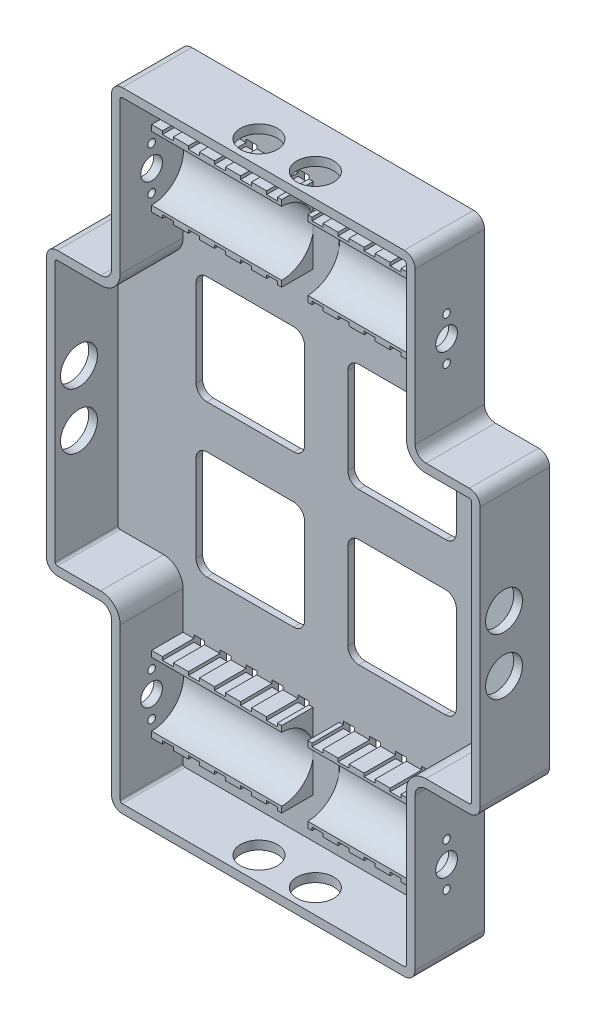
from build123d import *

# Parameters (mm, degrees)
BOSS_EXTRUDE1_DEPTH                          = 3
FILLET1_R                                    = 5
BOSS_EXTRUDE2_START                          = 29
BOSS_EXTRUDE2_DEPTH                          = 29
SKETCH3_R                                    = 5
SKETCH3_R_2                                  = 1.75
CUT_EXTRUDE1_DEPTH                           = 29
SKETCH4_W                                    = 60
SKETCH4_H                                    = 35
BOSS_EXTRUDE3_DEPTH                          = 14.5
SKETCH5_R                                    = 14.75
CUT_EXTRUDE2_DEPTH                           = 60
SKETCH7_W                                    = 5
SKETCH7_H                                    = 3
CUT_EXTRUDE3_DEPTH                           = 178.006355818
CUT_EXTRUDE4_DEPTH                           = 5
LPATTERN1_COUNT                              = 5
LPATTERN1_PITCH                              = 12
MIRROR1_COPY_1_SKETCH_W                      = 5
MIRROR1_COPY_1_SKETCH_H                      = 3
MIRROR1_COPY_1_DEPTH                         = 178.006355818
MIRROR1_COPY_2_SKETCH_W                      = 5
MIRROR1_COPY_2_SKETCH_H                      = 3
MIRROR1_COPY_2_DEPTH                         = 178.006355818
MIRROR1_COPY_3_SKETCH_W                      = 5
MIRROR1_COPY_3_SKETCH_H                      = 3
MIRROR1_COPY_3_DEPTH                         = 178.006355818
MIRROR1_COPY_4_SKETCH_W                      = 5
MIRROR1_COPY_4_SKETCH_H                      = 3
MIRROR1_COPY_4_DEPTH                         = 178.006355818
MIRROR1_COPY_5_DEPTH                         = 5
MIRROR1_COPY_6_DEPTH                         = 5
MIRROR1_COPY_7_DEPTH                         = 5
MIRROR1_COPY_8_DEPTH                         = 5
MIRROR1_AT_THE_SECOND_PLANE_COPY_1_SKETC_W   = 5
MIRROR1_AT_THE_SECOND_PLANE_COPY_1_SKETC_H   = 3
MIRROR1_AT_THE_SECOND_PLANE_COPY_1_DEPTH     = 178.006355818
MIRROR1_AT_THE_SECOND_PLANE_COPY_2_SKETC_W   = 5
MIRROR1_AT_THE_SECOND_PLANE_COPY_2_SKETC_H   = 3
MIRROR1_AT_THE_SECOND_PLANE_COPY_2_DEPTH     = 178.006355818
MIRROR1_AT_THE_SECOND_PLANE_COPY_3_SKETC_W   = 5
MIRROR1_AT_THE_SECOND_PLANE_COPY_3_SKETC_H   = 3
MIRROR1_AT_THE_SECOND_PLANE_COPY_3_DEPTH     = 178.006355818
MIRROR1_AT_THE_SECOND_PLANE_COPY_4_SKETC_W   = 5
MIRROR1_AT_THE_SECOND_PLANE_COPY_4_SKETC_H   = 3
MIRROR1_AT_THE_SECOND_PLANE_COPY_4_DEPTH     = 178.006355818
MIRROR1_AT_THE_SECOND_PLANE_COPY_5_DEPTH     = 5
MIRROR1_AT_THE_SECOND_PLANE_COPY_6_DEPTH     = 5
MIRROR1_AT_THE_SECOND_PLANE_COPY_7_DEPTH     = 5
MIRROR1_AT_THE_SECOND_PLANE_COPY_8_DEPTH     = 5
MIRROR1_AT_THE_SECOND_PLANE_COPY_9_SKETC_R   = 5
MIRROR1_AT_THE_SECOND_PLANE_COPY_9_SKETC_R_2 = 1.75
MIRROR1_AT_THE_SECOND_PLANE_COPY_9_DEPTH     = 29
MIRROR1_AT_THE_SECOND_PLANE_COPY_10_SKET_W   = 60
MIRROR1_AT_THE_SECOND_PLANE_COPY_10_SKET_H   = 35
MIRROR1_AT_THE_SECOND_PLANE_COPY_10_DEPTH    = 14.5
MIRROR1_AT_THE_SECOND_PLANE_COPY_11_SKET_R   = 14.75
MIRROR1_AT_THE_SECOND_PLANE_COPY_11_DEPTH    = 60
MIRROR1_AT_THE_SECOND_PLANE_COPY_12_SKET_W   = 5
MIRROR1_AT_THE_SECOND_PLANE_COPY_12_SKET_H   = 3
MIRROR1_AT_THE_SECOND_PLANE_COPY_12_DEPTH    = 178.006355818
MIRROR1_AT_THE_SECOND_PLANE_COPY_13_DEPTH    = 5
MIRROR1_AT_THE_SECOND_PLANE_COPY_14_SKET_W   = 5
MIRROR1_AT_THE_SECOND_PLANE_COPY_14_SKET_H   = 3
MIRROR1_AT_THE_SECOND_PLANE_COPY_14_DEPTH    = 178.006355818
MIRROR1_AT_THE_SECOND_PLANE_COPY_15_SKET_W   = 5
MIRROR1_AT_THE_SECOND_PLANE_COPY_15_SKET_H   = 3
MIRROR1_AT_THE_SECOND_PLANE_COPY_15_DEPTH    = 178.006355818
MIRROR1_AT_THE_SECOND_PLANE_COPY_16_SKET_W   = 5
MIRROR1_AT_THE_SECOND_PLANE_COPY_16_SKET_H   = 3
MIRROR1_AT_THE_SECOND_PLANE_COPY_16_DEPTH    = 178.006355818
MIRROR1_AT_THE_SECOND_PLANE_COPY_17_SKET_W   = 5
MIRROR1_AT_THE_SECOND_PLANE_COPY_17_SKET_H   = 3
MIRROR1_AT_THE_SECOND_PLANE_COPY_17_DEPTH    = 178.006355818
MIRROR1_AT_THE_SECOND_PLANE_COPY_18_DEPTH    = 5
MIRROR1_AT_THE_SECOND_PLANE_COPY_19_DEPTH    = 5
MIRROR1_AT_THE_SECOND_PLANE_COPY_20_DEPTH    = 5
MIRROR1_AT_THE_SECOND_PLANE_COPY_21_DEPTH    = 5
CUT_EXTRUDE6_REACH                           = 310.422
SKETCH11_R                                   = 8.5
SKETCH12_R                                   = 8.5
CUT_EXTRUDE7_DEPTH                           = 250.096366894
CUT_EXTRUDE8_DEPTH                           = 180.022344974
MIRROR3_AT_THE_SECOND_PLANE_COPY_1_DEPTH     = 180.022344974


with BuildPart() as part:
    # Sketch1 → Boss-Extrude1 (new body)
    with BuildSketch(Plane.XY):
        Polygon((-70, -145), (70, -145), (70, -65), (100, -65), (100, 65), (70, 65), (70, 145), (-70, 145), (-70, 65), (-100, 65), (-100, -65), (-70, -65), align=None)
    extrude(amount=BOSS_EXTRUDE1_DEPTH)

    # Fillet1
    fillet1_edges = [part.edges().sort_by_distance(p)[0] for p in [
        (-70, -65, 1.5),
        (-100, -65, 1.5),
        (-100, 65, 1.5),
        (-70, 65, 1.5),
        (-70, 145, 1.5),
        (70, 145, 1.5),
        (70, 65, 1.5),
        (100, 65, 1.5),
        (100, -65, 1.5),
        (70, -65, 1.5),
        (70, -145, 1.5),
        (-70, -145, 1.5),
    ]]
    fillet(fillet1_edges, radius=FILLET1_R)

    # Sketch2 → Boss-Extrude2 (add)
    with BuildSketch(Plane.XY.offset(3).offset(BOSS_EXTRUDE2_START)):
        with BuildLine():
            Line((-100, 60), (-100, -60))
            ThreePointArc((-100, -60), (-98.535533906, -63.535533906), (-95, -65))
            Line((-95, -65), (-75, -65))
            ThreePointArc((-75, -65), (-71.464466094, -66.464466094), (-70, -70))
            Line((-70, -70), (-70, -140))
            ThreePointArc((-70, -140), (-68.535533906, -143.535533906), (-65, -145))
            Line((-65, -145), (65, -145))
            ThreePointArc((65, -145), (68.535533906, -143.535533906), (70, -140))
            Line((70, -140), (70, -70))
            ThreePointArc((70, -70), (71.464466094, -66.464466094), (75, -65))
            Line((75, -65), (95, -65))
            ThreePointArc((95, -65), (98.535533906, -63.535533906), (100, -60))
            Line((100, -60), (100, 60))
            ThreePointArc((100, 60), (98.535533906, 63.535533906), (95, 65))
            Line((95, 65), (75, 65))
            ThreePointArc((75, 65), (71.464466094, 66.464466094), (70, 70))
            Line((70, 70), (70, 140))
            ThreePointArc((70, 140), (68.535533906, 143.535533906), (65, 145))
            Line((65, 145), (-65, 145))
            ThreePointArc((-65, 145), (-68.535533906, 143.535533906), (-70, 140))
            Line((-70, 140), (-70, 70))
            ThreePointArc((-70, 70), (-71.464466094, 66.464466094), (-75, 65))
            Line((-75, 65), (-95, 65))
            ThreePointArc((-95, 65), (-98.535533906, 63.535533906), (-100, 60))
        make_face()
        with BuildLine():
            Line((-96, 60), (-96, -60))
            ThreePointArc((-96, -60), (-95.707106781, -60.707106781), (-95, -61))
            Line((-95, -61), (-75, -61))
            ThreePointArc((-75, -61), (-68.636038969, -63.636038969), (-66, -70))
            Line((-66, -70), (-66, -140))
            ThreePointArc((-66, -140), (-65.707106781, -140.707106781), (-65, -141))
            Line((-65, -141), (65, -141))
            ThreePointArc((65, -141), (65.707106781, -140.707106781), (66, -140))
            Line((66, -140), (66, -70))
            ThreePointArc((66, -70), (68.636038969, -63.636038969), (75, -61))
            Line((75, -61), (95, -61))
            ThreePointArc((95, -61), (95.707106781, -60.707106781), (96, -60))
            Line((96, -60), (96, 60))
            ThreePointArc((96, 60), (95.707106781, 60.707106781), (95, 61))
            Line((95, 61), (75, 61))
            ThreePointArc((75, 61), (68.636038969, 63.636038969), (66, 70))
            Line((66, 70), (66, 140))
            ThreePointArc((66, 140), (65.707106781, 140.707106781), (65, 141))
            Line((65, 141), (-65, 141))
            ThreePointArc((-65, 141), (-65.707106781, 140.707106781), (-66, 140))
            Line((-66, 140), (-66, 70))
            ThreePointArc((-66, 70), (-68.636038969, 63.636038969), (-75, 61))
            Line((-75, 61), (-95, 61))
            ThreePointArc((-95, 61), (-95.707106781, 60.707106781), (-96, 60))
        make_face(mode=Mode.SUBTRACT)
    extrude(amount=-BOSS_EXTRUDE2_DEPTH)

    # Sketch3 → Cut-Extrude1 (cut)
    with BuildSketch(Plane.ZY.offset(70)):
        with Locations(Location((17.5, -105, 0), (0, 0, 270))):
            Circle(SKETCH3_R)
        with Locations(Location((17.5, -95, 0), (0, 0, 270))):
            Circle(SKETCH3_R_2)
        with Locations(Location((17.5, -115, 0), (0, 0, 270))):
            Circle(SKETCH3_R_2)
    cut_extrude1 = extrude(amount=-CUT_EXTRUDE1_DEPTH, mode=Mode.SUBTRACT)

    # Sketch4 → Boss-Extrude3 (add)
    with BuildSketch(Plane.XY.offset(3)):
        with Locations((-36, -105)):
            Rectangle(SKETCH4_W, SKETCH4_H)
    boss_extrude3 = extrude(amount=BOSS_EXTRUDE3_DEPTH)

    # Sketch5 → Cut-Extrude2 (cut)
    with BuildSketch(Plane(origin=(-6, 0, 0), x_dir=(0, 0, -1), z_dir=(1, 0, 0))):
        with Locations((-17.5, -105)):
            Circle(SKETCH5_R)
    cut_extrude2 = extrude(amount=-CUT_EXTRUDE2_DEPTH, mode=Mode.SUBTRACT)

    # Sketch7 → Cut-Extrude3 (cut, through all)
    with BuildSketch(Plane.XY.offset(17.5)):
        with Locations((-58.5, -122.5)):
            Rectangle(SKETCH7_W, SKETCH7_H)
        with Locations((-58.5, -87.5)):
            Rectangle(SKETCH7_W, SKETCH7_H)
    cut_extrude3 = extrude(amount=-CUT_EXTRUDE3_DEPTH, mode=Mode.SUBTRACT)

    # Sketch8 → Cut-Extrude4 (cut)
    with BuildSketch(Plane(origin=(-61, 0, 0), x_dir=(0, 0, -1), z_dir=(1, 0, 0))):
        Polygon((0, -89), (0, -121), (-3, -121), (-1.5, -119.5), (-1.5, -90.5), (-3, -89), align=None)
    cut_extrude4 = extrude(amount=CUT_EXTRUDE4_DEPTH, mode=Mode.SUBTRACT)

    # LPattern1: Cut-Extrude3, Cut-Extrude4 ×5
    with Locations(*[(i * LPATTERN1_PITCH, 0, 0) for i in range(1, LPATTERN1_COUNT)]):
        add(cut_extrude3, mode=Mode.SUBTRACT)
        add(cut_extrude4, mode=Mode.SUBTRACT)

    # Mirror1: Cut-Extrude1, Boss-Extrude3, Cut-Extrude2, Cut-Extrude3, Cut-Extrude4 across plane
    add(cut_extrude1.mirror(Plane(origin=(0, 0, 0), x_dir=(0, 0, 1), z_dir=(1, 0, 0))), mode=Mode.SUBTRACT)
    add(boss_extrude3.mirror(Plane(origin=(0, 0, 0), x_dir=(0, 0, 1), z_dir=(1, 0, 0))))
    add(cut_extrude2.mirror(Plane(origin=(0, 0, 0), x_dir=(0, 0, 1), z_dir=(1, 0, 0))), mode=Mode.SUBTRACT)
    add(cut_extrude3.mirror(Plane(origin=(0, 0, 0), x_dir=(0, 0, 1), z_dir=(1, 0, 0))), mode=Mode.SUBTRACT)
    add(cut_extrude4.mirror(Plane(origin=(0, 0, 0), x_dir=(0, 0, 1), z_dir=(1, 0, 0))), mode=Mode.SUBTRACT)

    # Mirror1 copy 1 sketch → Mirror1 copy 1 (cut, through all)
    with BuildSketch(Plane(origin=(-12, 0, 17.5), x_dir=(-1, 0, 0), z_dir=(0, 0, 1))):
        with Locations((-58.5, 122.5)):
            Rectangle(MIRROR1_COPY_1_SKETCH_W, MIRROR1_COPY_1_SKETCH_H)
        with Locations((-58.5, 87.5)):
            Rectangle(MIRROR1_COPY_1_SKETCH_W, MIRROR1_COPY_1_SKETCH_H)
    extrude(amount=-MIRROR1_COPY_1_DEPTH, mode=Mode.SUBTRACT)

    # Mirror1 copy 2 sketch → Mirror1 copy 2 (cut, through all)
    with BuildSketch(Plane(origin=(-24, 0, 17.5), x_dir=(-1, 0, 0), z_dir=(0, 0, 1))):
        with Locations((-58.5, 122.5)):
            Rectangle(MIRROR1_COPY_2_SKETCH_W, MIRROR1_COPY_2_SKETCH_H)
        with Locations((-58.5, 87.5)):
            Rectangle(MIRROR1_COPY_2_SKETCH_W, MIRROR1_COPY_2_SKETCH_H)
    extrude(amount=-MIRROR1_COPY_2_DEPTH, mode=Mode.SUBTRACT)

    # Mirror1 copy 3 sketch → Mirror1 copy 3 (cut, through all)
    with BuildSketch(Plane(origin=(-36, 0, 17.5), x_dir=(-1, 0, 0), z_dir=(0, 0, 1))):
        with Locations((-58.5, 122.5)):
            Rectangle(MIRROR1_COPY_3_SKETCH_W, MIRROR1_COPY_3_SKETCH_H)
        with Locations((-58.5, 87.5)):
            Rectangle(MIRROR1_COPY_3_SKETCH_W, MIRROR1_COPY_3_SKETCH_H)
    extrude(amount=-MIRROR1_COPY_3_DEPTH, mode=Mode.SUBTRACT)

    # Mirror1 copy 4 sketch → Mirror1 copy 4 (cut, through all)
    with BuildSketch(Plane(origin=(-48, 0, 17.5), x_dir=(-1, 0, 0), z_dir=(0, 0, 1))):
        with Locations((-58.5, 122.5)):
            Rectangle(MIRROR1_COPY_4_SKETCH_W, MIRROR1_COPY_4_SKETCH_H)
        with Locations((-58.5, 87.5)):
            Rectangle(MIRROR1_COPY_4_SKETCH_W, MIRROR1_COPY_4_SKETCH_H)
    extrude(amount=-MIRROR1_COPY_4_DEPTH, mode=Mode.SUBTRACT)

    # Mirror1 copy 5 sketch → Mirror1 copy 5 (cut)
    with BuildSketch(Plane(origin=(49, 0, 0), x_dir=(0, 0, -1), z_dir=(-1, 0, 0))):
        Polygon((0, 89), (0, 121), (-3, 121), (-1.5, 119.5), (-1.5, 90.5), (-3, 89), align=None)
    extrude(amount=MIRROR1_COPY_5_DEPTH, mode=Mode.SUBTRACT)

    # Mirror1 copy 6 sketch → Mirror1 copy 6 (cut)
    with BuildSketch(Plane(origin=(37, 0, 0), x_dir=(0, 0, -1), z_dir=(-1, 0, 0))):
        Polygon((0, 89), (0, 121), (-3, 121), (-1.5, 119.5), (-1.5, 90.5), (-3, 89), align=None)
    extrude(amount=MIRROR1_COPY_6_DEPTH, mode=Mode.SUBTRACT)

    # Mirror1 copy 7 sketch → Mirror1 copy 7 (cut)
    with BuildSketch(Plane(origin=(25, 0, 0), x_dir=(0, 0, -1), z_dir=(-1, 0, 0))):
        Polygon((0, 89), (0, 121), (-3, 121), (-1.5, 119.5), (-1.5, 90.5), (-3, 89), align=None)
    extrude(amount=MIRROR1_COPY_7_DEPTH, mode=Mode.SUBTRACT)

    # Mirror1 copy 8 sketch → Mirror1 copy 8 (cut)
    with BuildSketch(Plane(origin=(13, 0, 0), x_dir=(0, 0, -1), z_dir=(-1, 0, 0))):
        Polygon((0, 89), (0, 121), (-3, 121), (-1.5, 119.5), (-1.5, 90.5), (-3, 89), align=None)
    extrude(amount=MIRROR1_COPY_8_DEPTH, mode=Mode.SUBTRACT)

    # Mirror1 at the second plane: Cut-Extrude1, Boss-Extrude3, Cut-Extrude2, Cut-Extrude3, Cut-Extrude4 across plane
    add(cut_extrude1.mirror(Plane.ZX), mode=Mode.SUBTRACT)
    add(boss_extrude3.mirror(Plane.ZX))
    add(cut_extrude2.mirror(Plane.ZX), mode=Mode.SUBTRACT)
    add(cut_extrude3.mirror(Plane.ZX), mode=Mode.SUBTRACT)
    add(cut_extrude4.mirror(Plane.ZX), mode=Mode.SUBTRACT)

    # Mirror1 at the second plane copy 1 sketc → Mirror1 at the second plane copy 1 (cut, through all)
    with BuildSketch(Plane(origin=(12, 0, 17.5), x_dir=(1, 0, 0), z_dir=(0, 0, 1))):
        with Locations((-58.5, 122.5)):
            Rectangle(MIRROR1_AT_THE_SECOND_PLANE_COPY_1_SKETC_W, MIRROR1_AT_THE_SECOND_PLANE_COPY_1_SKETC_H)
        with Locations((-58.5, 87.5)):
            Rectangle(MIRROR1_AT_THE_SECOND_PLANE_COPY_1_SKETC_W, MIRROR1_AT_THE_SECOND_PLANE_COPY_1_SKETC_H)
    extrude(amount=-MIRROR1_AT_THE_SECOND_PLANE_COPY_1_DEPTH, mode=Mode.SUBTRACT)

    # Mirror1 at the second plane copy 2 sketc → Mirror1 at the second plane copy 2 (cut, through all)
    with BuildSketch(Plane(origin=(24, 0, 17.5), x_dir=(1, 0, 0), z_dir=(0, 0, 1))):
        with Locations((-58.5, 122.5)):
            Rectangle(MIRROR1_AT_THE_SECOND_PLANE_COPY_2_SKETC_W, MIRROR1_AT_THE_SECOND_PLANE_COPY_2_SKETC_H)
        with Locations((-58.5, 87.5)):
            Rectangle(MIRROR1_AT_THE_SECOND_PLANE_COPY_2_SKETC_W, MIRROR1_AT_THE_SECOND_PLANE_COPY_2_SKETC_H)
    extrude(amount=-MIRROR1_AT_THE_SECOND_PLANE_COPY_2_DEPTH, mode=Mode.SUBTRACT)

    # Mirror1 at the second plane copy 3 sketc → Mirror1 at the second plane copy 3 (cut, through all)
    with BuildSketch(Plane(origin=(36, 0, 17.5), x_dir=(1, 0, 0), z_dir=(0, 0, 1))):
        with Locations((-58.5, 122.5)):
            Rectangle(MIRROR1_AT_THE_SECOND_PLANE_COPY_3_SKETC_W, MIRROR1_AT_THE_SECOND_PLANE_COPY_3_SKETC_H)
        with Locations((-58.5, 87.5)):
            Rectangle(MIRROR1_AT_THE_SECOND_PLANE_COPY_3_SKETC_W, MIRROR1_AT_THE_SECOND_PLANE_COPY_3_SKETC_H)
    extrude(amount=-MIRROR1_AT_THE_SECOND_PLANE_COPY_3_DEPTH, mode=Mode.SUBTRACT)

    # Mirror1 at the second plane copy 4 sketc → Mirror1 at the second plane copy 4 (cut, through all)
    with BuildSketch(Plane(origin=(48, 0, 17.5), x_dir=(1, 0, 0), z_dir=(0, 0, 1))):
        with Locations((-58.5, 122.5)):
            Rectangle(MIRROR1_AT_THE_SECOND_PLANE_COPY_4_SKETC_W, MIRROR1_AT_THE_SECOND_PLANE_COPY_4_SKETC_H)
        with Locations((-58.5, 87.5)):
            Rectangle(MIRROR1_AT_THE_SECOND_PLANE_COPY_4_SKETC_W, MIRROR1_AT_THE_SECOND_PLANE_COPY_4_SKETC_H)
    extrude(amount=-MIRROR1_AT_THE_SECOND_PLANE_COPY_4_DEPTH, mode=Mode.SUBTRACT)

    # Mirror1 at the second plane copy 5 sketc → Mirror1 at the second plane copy 5 (cut)
    with BuildSketch(Plane(origin=(-49, 0, 0), x_dir=(0, 0, -1), z_dir=(1, 0, 0))):
        Polygon((0, 89), (0, 121), (-3, 121), (-1.5, 119.5), (-1.5, 90.5), (-3, 89), align=None)
    extrude(amount=MIRROR1_AT_THE_SECOND_PLANE_COPY_5_DEPTH, mode=Mode.SUBTRACT)

    # Mirror1 at the second plane copy 6 sketc → Mirror1 at the second plane copy 6 (cut)
    with BuildSketch(Plane(origin=(-37, 0, 0), x_dir=(0, 0, -1), z_dir=(1, 0, 0))):
        Polygon((0, 89), (0, 121), (-3, 121), (-1.5, 119.5), (-1.5, 90.5), (-3, 89), align=None)
    extrude(amount=MIRROR1_AT_THE_SECOND_PLANE_COPY_6_DEPTH, mode=Mode.SUBTRACT)

    # Mirror1 at the second plane copy 7 sketc → Mirror1 at the second plane copy 7 (cut)
    with BuildSketch(Plane(origin=(-25, 0, 0), x_dir=(0, 0, -1), z_dir=(1, 0, 0))):
        Polygon((0, 89), (0, 121), (-3, 121), (-1.5, 119.5), (-1.5, 90.5), (-3, 89), align=None)
    extrude(amount=MIRROR1_AT_THE_SECOND_PLANE_COPY_7_DEPTH, mode=Mode.SUBTRACT)

    # Mirror1 at the second plane copy 8 sketc → Mirror1 at the second plane copy 8 (cut)
    with BuildSketch(Plane(origin=(-13, 0, 0), x_dir=(0, 0, -1), z_dir=(1, 0, 0))):
        Polygon((0, 89), (0, 121), (-3, 121), (-1.5, 119.5), (-1.5, 90.5), (-3, 89), align=None)
    extrude(amount=MIRROR1_AT_THE_SECOND_PLANE_COPY_8_DEPTH, mode=Mode.SUBTRACT)

    # Mirror1 at the second plane copy 9 sketc → Mirror1 at the second plane copy 9 (cut)
    with BuildSketch(Plane(origin=(70, 0, 0), x_dir=(0, 0, 1), z_dir=(1, 0, 0))):
        with Locations(Location((17.5, -105, 0), (0, 0, 270))):
            Circle(MIRROR1_AT_THE_SECOND_PLANE_COPY_9_SKETC_R)
        with Locations(Location((17.5, -95, 0), (0, 0, 270))):
            Circle(MIRROR1_AT_THE_SECOND_PLANE_COPY_9_SKETC_R_2)
        with Locations(Location((17.5, -115, 0), (0, 0, 270))):
            Circle(MIRROR1_AT_THE_SECOND_PLANE_COPY_9_SKETC_R_2)
    extrude(amount=-MIRROR1_AT_THE_SECOND_PLANE_COPY_9_DEPTH, mode=Mode.SUBTRACT)

    # Mirror1 at the second plane copy 10 sket → Mirror1 at the second plane copy 10 (add)
    with BuildSketch(Plane(origin=(0, 0, 3), x_dir=(-1, 0, 0), z_dir=(0, 0, 1))):
        with Locations((-36, -105)):
            Rectangle(MIRROR1_AT_THE_SECOND_PLANE_COPY_10_SKET_W, MIRROR1_AT_THE_SECOND_PLANE_COPY_10_SKET_H)
    extrude(amount=MIRROR1_AT_THE_SECOND_PLANE_COPY_10_DEPTH)

    # Mirror1 at the second plane copy 11 sket → Mirror1 at the second plane copy 11 (cut)
    with BuildSketch(Plane(origin=(6, 0, 0), x_dir=(0, 0, -1), z_dir=(-1, 0, 0))):
        with Locations((-17.5, -105)):
            Circle(MIRROR1_AT_THE_SECOND_PLANE_COPY_11_SKET_R)
    extrude(amount=-MIRROR1_AT_THE_SECOND_PLANE_COPY_11_DEPTH, mode=Mode.SUBTRACT)

    # Mirror1 at the second plane copy 12 sket → Mirror1 at the second plane copy 12 (cut, through all)
    with BuildSketch(Plane(origin=(0, 0, 17.5), x_dir=(-1, 0, 0), z_dir=(0, 0, 1))):
        with Locations((-58.5, -122.5)):
            Rectangle(MIRROR1_AT_THE_SECOND_PLANE_COPY_12_SKET_W, MIRROR1_AT_THE_SECOND_PLANE_COPY_12_SKET_H)
        with Locations((-58.5, -87.5)):
            Rectangle(MIRROR1_AT_THE_SECOND_PLANE_COPY_12_SKET_W, MIRROR1_AT_THE_SECOND_PLANE_COPY_12_SKET_H)
    extrude(amount=-MIRROR1_AT_THE_SECOND_PLANE_COPY_12_DEPTH, mode=Mode.SUBTRACT)

    # Mirror1 at the second plane copy 13 sket → Mirror1 at the second plane copy 13 (cut)
    with BuildSketch(Plane(origin=(61, 0, 0), x_dir=(0, 0, -1), z_dir=(-1, 0, 0))):
        Polygon((0, -89), (0, -121), (-3, -121), (-1.5, -119.5), (-1.5, -90.5), (-3, -89), align=None)
    extrude(amount=MIRROR1_AT_THE_SECOND_PLANE_COPY_13_DEPTH, mode=Mode.SUBTRACT)

    # Mirror1 at the second plane copy 14 sket → Mirror1 at the second plane copy 14 (cut, through all)
    with BuildSketch(Plane(origin=(-12, 0, 17.5), x_dir=(-1, 0, 0), z_dir=(0, 0, 1))):
        with Locations((-58.5, -122.5)):
            Rectangle(MIRROR1_AT_THE_SECOND_PLANE_COPY_14_SKET_W, MIRROR1_AT_THE_SECOND_PLANE_COPY_14_SKET_H)
        with Locations((-58.5, -87.5)):
            Rectangle(MIRROR1_AT_THE_SECOND_PLANE_COPY_14_SKET_W, MIRROR1_AT_THE_SECOND_PLANE_COPY_14_SKET_H)
    extrude(amount=-MIRROR1_AT_THE_SECOND_PLANE_COPY_14_DEPTH, mode=Mode.SUBTRACT)

    # Mirror1 at the second plane copy 15 sket → Mirror1 at the second plane copy 15 (cut, through all)
    with BuildSketch(Plane(origin=(-24, 0, 17.5), x_dir=(-1, 0, 0), z_dir=(0, 0, 1))):
        with Locations((-58.5, -122.5)):
            Rectangle(MIRROR1_AT_THE_SECOND_PLANE_COPY_15_SKET_W, MIRROR1_AT_THE_SECOND_PLANE_COPY_15_SKET_H)
        with Locations((-58.5, -87.5)):
            Rectangle(MIRROR1_AT_THE_SECOND_PLANE_COPY_15_SKET_W, MIRROR1_AT_THE_SECOND_PLANE_COPY_15_SKET_H)
    extrude(amount=-MIRROR1_AT_THE_SECOND_PLANE_COPY_15_DEPTH, mode=Mode.SUBTRACT)

    # Mirror1 at the second plane copy 16 sket → Mirror1 at the second plane copy 16 (cut, through all)
    with BuildSketch(Plane(origin=(-36, 0, 17.5), x_dir=(-1, 0, 0), z_dir=(0, 0, 1))):
        with Locations((-58.5, -122.5)):
            Rectangle(MIRROR1_AT_THE_SECOND_PLANE_COPY_16_SKET_W, MIRROR1_AT_THE_SECOND_PLANE_COPY_16_SKET_H)
        with Locations((-58.5, -87.5)):
            Rectangle(MIRROR1_AT_THE_SECOND_PLANE_COPY_16_SKET_W, MIRROR1_AT_THE_SECOND_PLANE_COPY_16_SKET_H)
    extrude(amount=-MIRROR1_AT_THE_SECOND_PLANE_COPY_16_DEPTH, mode=Mode.SUBTRACT)

    # Mirror1 at the second plane copy 17 sket → Mirror1 at the second plane copy 17 (cut, through all)
    with BuildSketch(Plane(origin=(-48, 0, 17.5), x_dir=(-1, 0, 0), z_dir=(0, 0, 1))):
        with Locations((-58.5, -122.5)):
            Rectangle(MIRROR1_AT_THE_SECOND_PLANE_COPY_17_SKET_W, MIRROR1_AT_THE_SECOND_PLANE_COPY_17_SKET_H)
        with Locations((-58.5, -87.5)):
            Rectangle(MIRROR1_AT_THE_SECOND_PLANE_COPY_17_SKET_W, MIRROR1_AT_THE_SECOND_PLANE_COPY_17_SKET_H)
    extrude(amount=-MIRROR1_AT_THE_SECOND_PLANE_COPY_17_DEPTH, mode=Mode.SUBTRACT)

    # Mirror1 at the second plane copy 18 sket → Mirror1 at the second plane copy 18 (cut)
    with BuildSketch(Plane(origin=(49, 0, 0), x_dir=(0, 0, -1), z_dir=(-1, 0, 0))):
        Polygon((0, -89), (0, -121), (-3, -121), (-1.5, -119.5), (-1.5, -90.5), (-3, -89), align=None)
    extrude(amount=MIRROR1_AT_THE_SECOND_PLANE_COPY_18_DEPTH, mode=Mode.SUBTRACT)

    # Mirror1 at the second plane copy 19 sket → Mirror1 at the second plane copy 19 (cut)
    with BuildSketch(Plane(origin=(37, 0, 0), x_dir=(0, 0, -1), z_dir=(-1, 0, 0))):
        Polygon((0, -89), (0, -121), (-3, -121), (-1.5, -119.5), (-1.5, -90.5), (-3, -89), align=None)
    extrude(amount=MIRROR1_AT_THE_SECOND_PLANE_COPY_19_DEPTH, mode=Mode.SUBTRACT)

    # Mirror1 at the second plane copy 20 sket → Mirror1 at the second plane copy 20 (cut)
    with BuildSketch(Plane(origin=(25, 0, 0), x_dir=(0, 0, -1), z_dir=(-1, 0, 0))):
        Polygon((0, -89), (0, -121), (-3, -121), (-1.5, -119.5), (-1.5, -90.5), (-3, -89), align=None)
    extrude(amount=MIRROR1_AT_THE_SECOND_PLANE_COPY_20_DEPTH, mode=Mode.SUBTRACT)

    # Mirror1 at the second plane copy 21 sket → Mirror1 at the second plane copy 21 (cut)
    with BuildSketch(Plane(origin=(13, 0, 0), x_dir=(0, 0, -1), z_dir=(-1, 0, 0))):
        Polygon((0, -89), (0, -121), (-3, -121), (-1.5, -119.5), (-1.5, -90.5), (-3, -89), align=None)
    extrude(amount=MIRROR1_AT_THE_SECOND_PLANE_COPY_21_DEPTH, mode=Mode.SUBTRACT)

    # Sketch11 → Cut-Extrude6 (cut, up to next)
    with BuildSketch(Plane(origin=(0, 145, 0), x_dir=(1, 0, 0), z_dir=(0, 1, 0)), mode=Mode.PRIVATE) as cut_extrude6_sk1:
        with Locations(Location((-13, -21, 0), (0, 0, 180))):
            Circle(SKETCH11_R)
    cut_extrude6_tool1 = extrude(cut_extrude6_sk1.sketch, amount=-CUT_EXTRUDE6_REACH, mode=Mode.PRIVATE) & part.part
    # Sketch11 → Cut-Extrude6 (cut, up to next)
    with BuildSketch(Plane(origin=(0, 145, 0), x_dir=(1, 0, 0), z_dir=(0, 1, 0)), mode=Mode.PRIVATE) as cut_extrude6_sk2:
        with Locations(Location((13, -21, 0), (0, 0, 180))):
            Circle(SKETCH11_R)
    cut_extrude6_tool2 = extrude(cut_extrude6_sk2.sketch, amount=-CUT_EXTRUDE6_REACH, mode=Mode.PRIVATE) & part.part
    cut_extrude6_1 = cut_extrude6_tool1.solids().sort_by_distance((-13, 145, 21))[0]
    add(cut_extrude6_1, mode=Mode.SUBTRACT)
    cut_extrude6_2 = cut_extrude6_tool2.solids().sort_by_distance((13, 145, 21))[0]
    add(cut_extrude6_2, mode=Mode.SUBTRACT)
    cut_extrude6 = cut_extrude6_1 + cut_extrude6_2  # Cut-Extrude6 as one shape, for the pattern or mirror that repeats it

    # Mirror2: Cut-Extrude6 across plane
    add(cut_extrude6.mirror(Plane.ZX), mode=Mode.SUBTRACT)

    # Sketch12 → Cut-Extrude7 (cut, through all)
    with BuildSketch(Plane(origin=(100, 0, 0), x_dir=(0, 0, -1), z_dir=(1, 0, 0))):
        with Locations((-21, 13)):
            Circle(SKETCH12_R)
        with Locations((-21, -13)):
            Circle(SKETCH12_R)
    extrude(amount=-CUT_EXTRUDE7_DEPTH, mode=Mode.SUBTRACT)

    # Sketch13 → Cut-Extrude8 (cut, through all)
    with BuildSketch(Plane(origin=(0, 0, 0), x_dir=(-1, 0, 0), z_dir=(0, 0, -1))):
        with BuildLine():
            Line((-55, 60), (-15, 60))
            ThreePointArc((-15, 60), (-11.464466094, 58.535533906), (-10, 55))
            Line((-10, 55), (-10, 15))
            ThreePointArc((-10, 15), (-11.464466094, 11.464466094), (-15, 10))
            Line((-15, 10), (-55, 10))
            ThreePointArc((-55, 10), (-58.535533906, 11.464466094), (-60, 15))
            Line((-60, 15), (-60, 55))
            ThreePointArc((-60, 55), (-58.535533906, 58.535533906), (-55, 60))
        make_face()
    cut_extrude8 = extrude(amount=-CUT_EXTRUDE8_DEPTH, mode=Mode.SUBTRACT)

    # Mirror3: Cut-Extrude8 across plane
    add(cut_extrude8.mirror(Plane(origin=(0, 0, 0), x_dir=(0, 0, 1), z_dir=(1, 0, 0))), mode=Mode.SUBTRACT)

    # Mirror3 at the second plane: Cut-Extrude8 across plane
    add(cut_extrude8.mirror(Plane.ZX), mode=Mode.SUBTRACT)

    # Mirror3 at the second plane copy 1 sketc → Mirror3 at the second plane copy 1 (cut, through all)
    with BuildSketch(Plane(origin=(0, 0, 0), x_dir=(1, 0, 0), z_dir=(0, 0, -1))):
        with BuildLine():
            Line((-55, 60), (-15, 60))
            ThreePointArc((-15, 60), (-11.464466094, 58.535533906), (-10, 55))
            Line((-10, 55), (-10, 15))
            ThreePointArc((-10, 15), (-11.464466094, 11.464466094), (-15, 10))
            Line((-15, 10), (-55, 10))
            ThreePointArc((-55, 10), (-58.535533906, 11.464466094), (-60, 15))
            Line((-60, 15), (-60, 55))
            ThreePointArc((-60, 55), (-58.535533906, 58.535533906), (-55, 60))
        make_face()
    extrude(amount=-MIRROR3_AT_THE_SECOND_PLANE_COPY_1_DEPTH, mode=Mode.SUBTRACT)


solid = part.part
